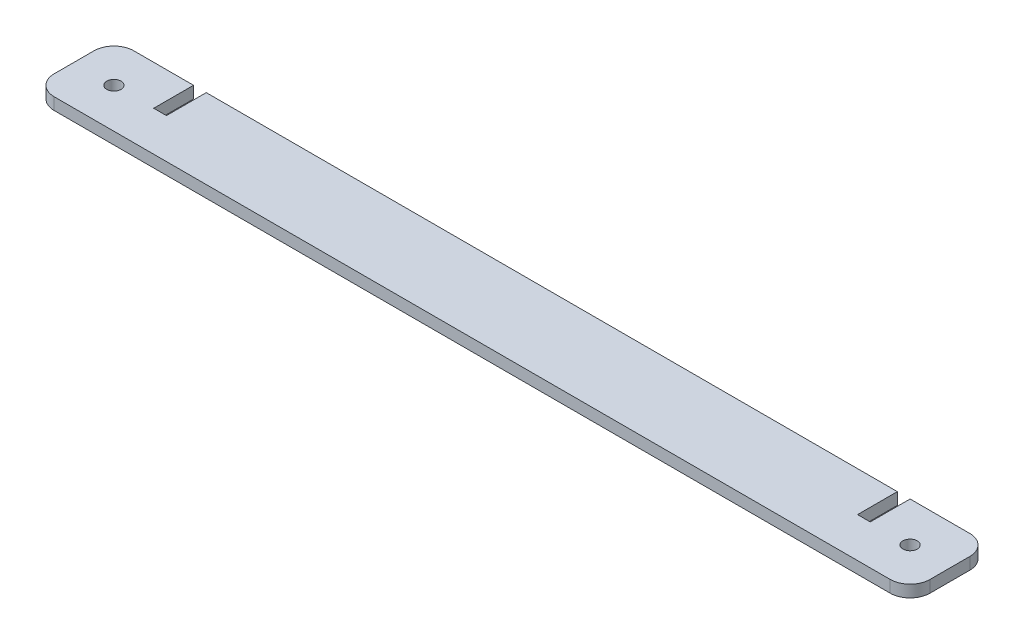
from build123d import *

# Parameters (mm, degrees)
SKETCH_1_R      = 1.8
EXTRUDE_1_DEPTH = 3


with BuildPart() as part:
    # 草图1 → 凸台-拉伸1 (new body)
    with BuildSketch(Plane(origin=(0, 0, 0), x_dir=(1, 0, 0), z_dir=(0, 1, 0))):
        with BuildLine():
            Line((-90, 10), (-90, 0))
            Line((-90, 0), (-86.8, 0))
            Line((-86.8, 0), (-86.8, 10))
            Line((-86.8, 10), (86.8, 10))
            Line((86.8, 10), (86.8, 0))
            Line((86.8, 0), (90, 0))
            Line((90, 0), (90, 10))
            Line((90, 10), (105, 10))
            ThreePointArc((105, 10), (108.535533906, 8.535533906), (110, 5))
            Line((110, 5), (110, -5))
            ThreePointArc((110, -5), (108.535533906, -8.535533906), (105, -10))
            Line((105, -10), (-105, -10))
            ThreePointArc((-105, -10), (-108.535533906, -8.535533906), (-110, -5))
            Line((-110, -5), (-110, 5))
            ThreePointArc((-110, 5), (-108.535533906, 8.535533906), (-105, 10))
            Line((-105, 10), (-90, 10))
        make_face()
        with Locations(Location((-100, 0, 0), (0, 0, 270))):
            Circle(SKETCH_1_R, mode=Mode.SUBTRACT)
        with Locations(Location((100, 0, 0), (0, 0, 270))):
            Circle(SKETCH_1_R, mode=Mode.SUBTRACT)
    extrude(amount=EXTRUDE_1_DEPTH)


solid = part.part
